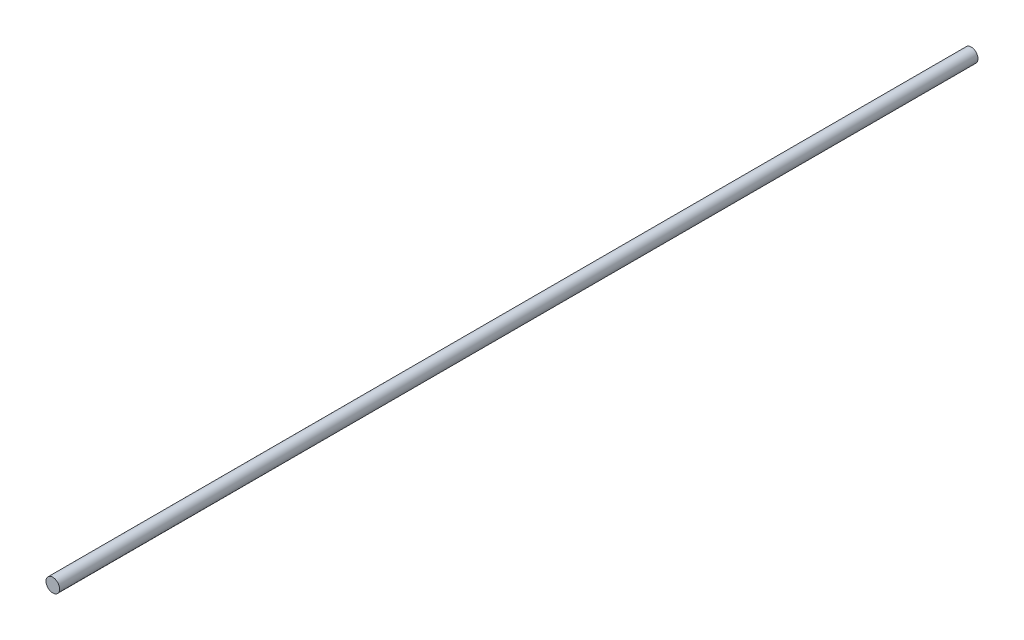
from build123d import *

# Parameters (mm, degrees)
SKETCH1_R           = 1
BOSS_EXTRUDE1_DEPTH = 135


with BuildPart() as part:
    # Sketch1 → Boss-Extrude1 (new body)
    with BuildSketch(Plane.XY):
        Circle(SKETCH1_R)
    extrude(amount=BOSS_EXTRUDE1_DEPTH)


solid = part.part
